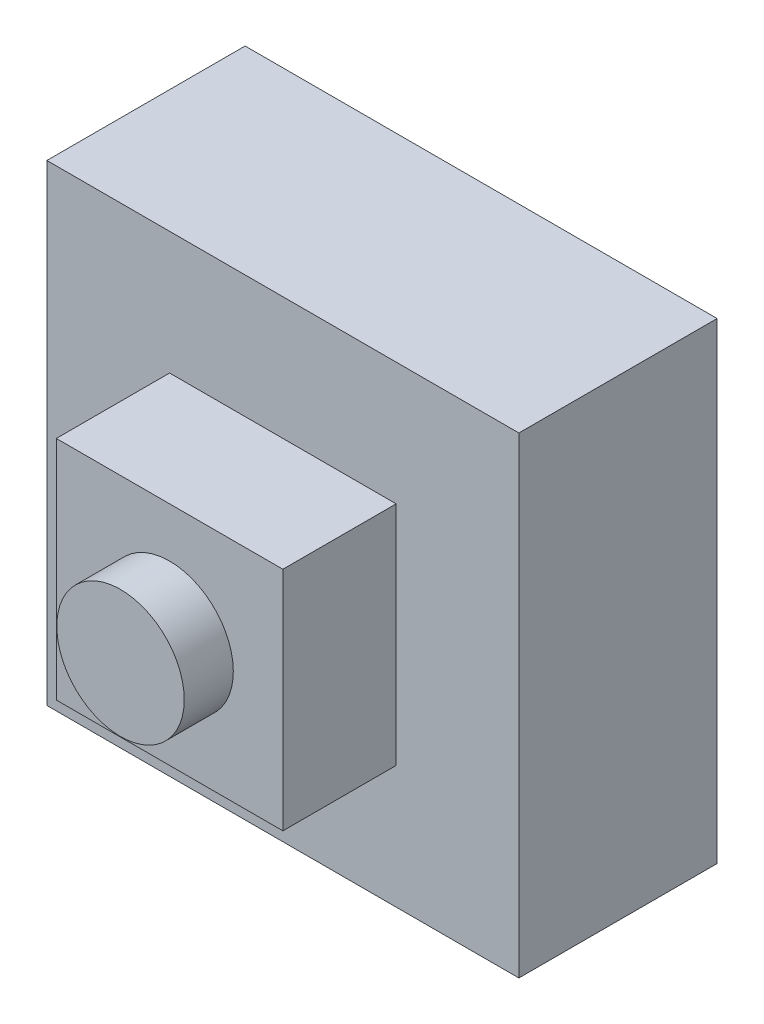
from build123d import *

# Parameters (mm, degrees)
SKETCH3_W           = 6.096
SKETCH3_H           = 6.096
BOSS_EXTRUDE1_DEPTH = 5.715
SKETCH4_R           = 1.7145
BOSS_EXTRUDE2_DEPTH = 1.3208
SKETCH5_W           = 12.7
SKETCH5_H           = 12.7
BOSS_EXTRUDE4_DEPTH = 2.667


with BuildPart() as part:
    # Sketch3 → Boss-Extrude1 (new, symmetric)
    with BuildSketch(Plane.XY):
        Rectangle(SKETCH3_W, SKETCH3_H)
    extrude(amount=BOSS_EXTRUDE1_DEPTH, both=True)

    # Sketch4 → Boss-Extrude2 (add)
    with BuildSketch(Plane.XY.offset(5.715)):
        Circle(SKETCH4_R)
    boss_extrude2 = extrude(amount=BOSS_EXTRUDE2_DEPTH)

    # Mirror1: Boss-Extrude2 across plane
    add(boss_extrude2.mirror(Plane.XY))

    # Sketch5 → Boss-Extrude4 (add, symmetric)
    with BuildSketch(Plane.XY):
        Rectangle(SKETCH5_W, SKETCH5_H)
    extrude(amount=BOSS_EXTRUDE4_DEPTH, both=True)


solid = part.part
